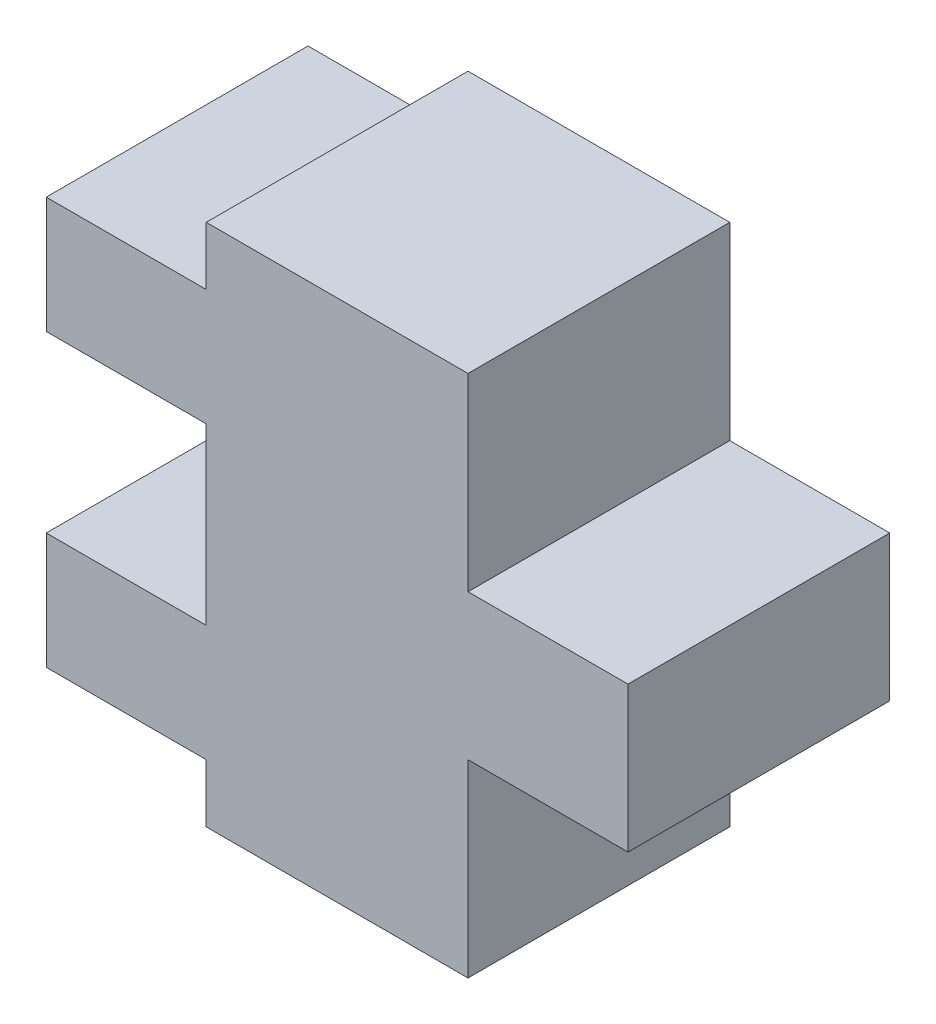
from build123d import *

# Parameters (mm, degrees)
COMPONENT_OUTLINE_DEPTH = 0.9


with BuildPart() as part:
    # 草图1 → Component_Outline (new body)
    with BuildSketch(Plane.XY):
        Polygon((1, -0.25), (0.45, -0.25), (0.45, -0.9), (-0.45, -0.9), (-0.45, -0.7), (-1, -0.7), (-1, -0.3), (-0.45, -0.3), (-0.45, 0.3), (-1, 0.3), (-1, 0.7), (-0.45, 0.7), (-0.45, 0.9), (0.45, 0.9), (0.45, 0.25), (1, 0.25), align=None)
    extrude(amount=COMPONENT_OUTLINE_DEPTH)


solid = part.part
